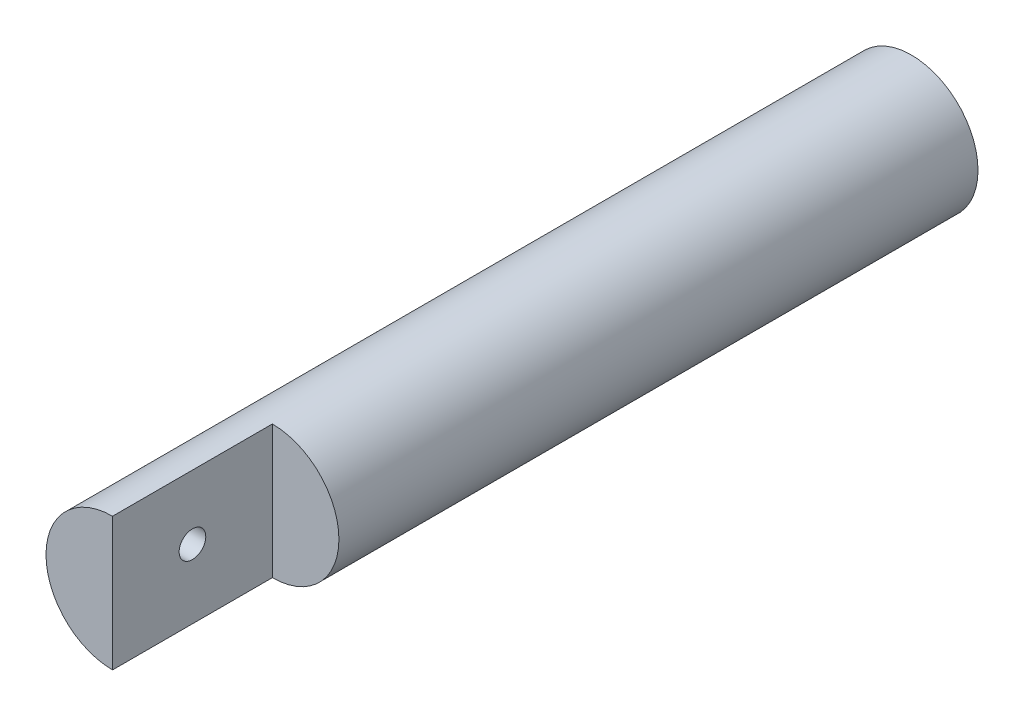
from build123d import *

# Parameters (mm, degrees)
SKETCH2_W           = 30
SKETCH2_H           = 30
BOSS_EXTRUDE2_DEPTH = 150
SKETCH3_R           = 2.5
CUT_EXTRUDE1_DEPTH  = 30
SKETCH4_OUTSIDE_W   = 63.176
SKETCH4_OUTSIDE_H   = 63.176
SKETCH4_OUTSIDE_R   = 12.5
CUT_EXTRUDE2_DEPTH  = 150
SKETCH5_R           = 11.5
CUT_EXTRUDE3_DEPTH  = 110
SKETCH7_W           = 12.5
SKETCH7_H           = 25
CUT_EXTRUDE4_DEPTH  = 30


with BuildPart() as part:
    # Sketch2 → Boss-Extrude2 (new body)
    with BuildSketch(Plane.XY):
        with Locations((-15, 15)):
            Rectangle(SKETCH2_W, SKETCH2_H)
    extrude(amount=BOSS_EXTRUDE2_DEPTH)

    # Sketch3 → Cut-Extrude1 (cut)
    with BuildSketch(Plane(origin=(0, 0, 0), x_dir=(0, 0, -1), z_dir=(1, 0, 0))):
        with Locations((-135, 15)):
            Circle(SKETCH3_R)
    extrude(amount=-CUT_EXTRUDE1_DEPTH, mode=Mode.SUBTRACT)

    # Sketch4 outside → Cut-Extrude2 (cut)
    with BuildSketch(Plane.XY.offset(150)):
        with Locations((-15, 15)):
            Rectangle(SKETCH4_OUTSIDE_W, SKETCH4_OUTSIDE_H)
        with Locations((-15, 14.551643442)):
            Circle(SKETCH4_OUTSIDE_R, mode=Mode.SUBTRACT)
    extrude(amount=-CUT_EXTRUDE2_DEPTH, mode=Mode.SUBTRACT)

    # Sketch5 → Cut-Extrude3 (cut)
    with BuildSketch(Plane(origin=(0, 0, 0), x_dir=(-1, 0, 0), z_dir=(0, 0, -1))):
        with Locations((15, 14.551643442)):
            Circle(SKETCH5_R)
    extrude(amount=-CUT_EXTRUDE3_DEPTH, mode=Mode.SUBTRACT)

    # Sketch7 → Cut-Extrude4 (cut)
    with BuildSketch(Plane.XY.offset(150)):
        with Locations((-8.75, 14.551643442)):
            Rectangle(SKETCH7_W, SKETCH7_H)
    extrude(amount=-CUT_EXTRUDE4_DEPTH, mode=Mode.SUBTRACT)


solid = part.part
